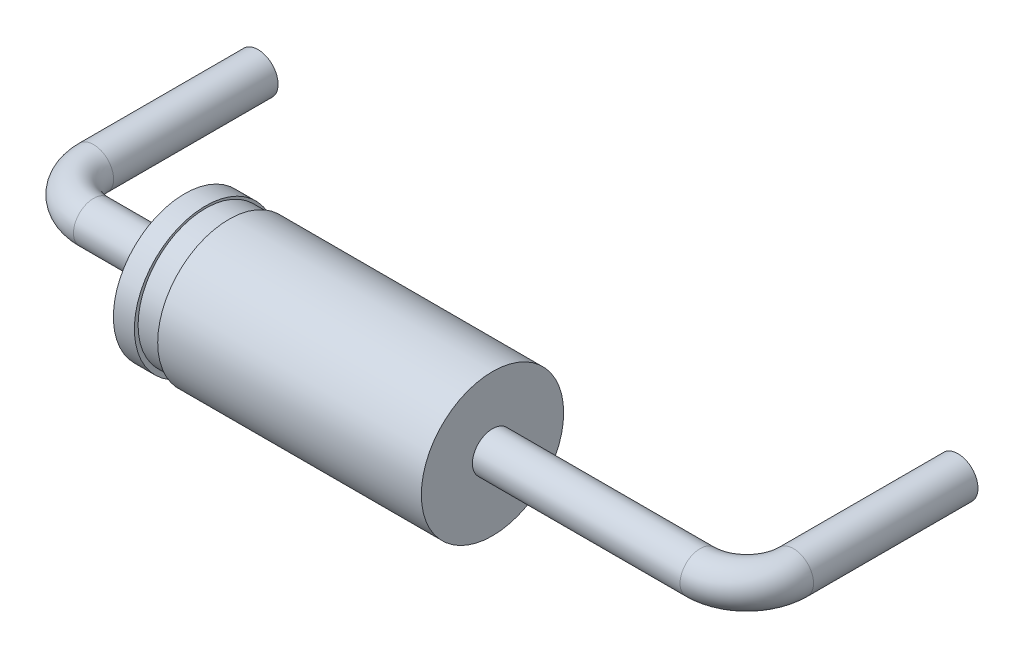
from build123d import *

# Parameters (mm, degrees)
SKETCH_3_R        = 1.525
EXTRUDE_1_DEPTH   = 6.6
SKETCH_4_W        = 0.5
SKETCH_4_H        = 0.3
SKETCH_6_R        = 0.43
EXTRUDE_2_DEPTH   = 3
EXTRUDE_2_2_DEPTH = 3
SKETCH_7_R        = 0.43


with BuildPart() as part:
    # Эскиз3 → Вытянуть1 (new body)
    with BuildSketch(Plane(origin=(2.95, 0, 0), x_dir=(0, 0, -1), z_dir=(1, 0, 0))):
        with Locations((-1.525, -0.033649265)):
            Circle(SKETCH_3_R)
    extrude(amount=EXTRUDE_1_DEPTH)

    # Эскиз4 → Вырез-Повернуть1 (revolve, cut)
    with BuildSketch(Plane(origin=(0, 0, 0), x_dir=(1, 0, 0), z_dir=(0, 1, 0)), mode=Mode.PRIVATE) as cut_revolve_1_sk:
        with Locations((3.65, 0.07)):
            Rectangle(SKETCH_4_W, SKETCH_4_H)
    revolve(cut_revolve_1_sk.sketch.rotate(Axis((0, 0, 1.525), (1, 0, 0)), 180), axis=Axis((0, 0, 1.525), (1, 0, 0)), mode=Mode.SUBTRACT)



with BuildPart() as body_2:
    # Эскиз6 → Вытянуть2 (new body)
    with BuildSketch(Plane.XY):
        Circle(SKETCH_6_R)
    extrude(amount=-EXTRUDE_2_DEPTH)


with BuildPart() as body_3:
    # Эскиз6 → Extrude 2 2 (new body)
    with BuildSketch(Plane.XY):
        with Locations(Location((15, 0, 0), (0, 0, 180))):
            Circle(SKETCH_6_R)
    extrude(amount=-EXTRUDE_2_2_DEPTH)


with BuildPart() as part_1:
    add(part.part)

    add(body_2.part)  # По траектории1 merges body 2

    add(body_3.part)  # По траектории1 merges body 3
    # По траектории1: sweep along a path in Эскиз5
    with BuildLine(Plane(origin=(0, 0, 0), x_dir=(1, 0, 0), z_dir=(0, 1, 0))) as sweep_1_path:
        Line((0, 0), (0, -0.525))
        ThreePointArc((0, -0.525), (0.292893219, -1.232106781), (1, -1.525))
        Line((1, -1.525), (6.8, -1.525))
        Line((6.8, -1.525), (14, -1.525))
        ThreePointArc((14, -1.525), (14.707106781, -1.232106781), (15, -0.525))
        Line((15, -0.525), (15, 0))
    # Эскиз7 → По траектории1 (sweep)
    with BuildSketch(Plane.XY):
        Circle(SKETCH_7_R)
    sweep(path=sweep_1_path.line)


solid = part_1.part
